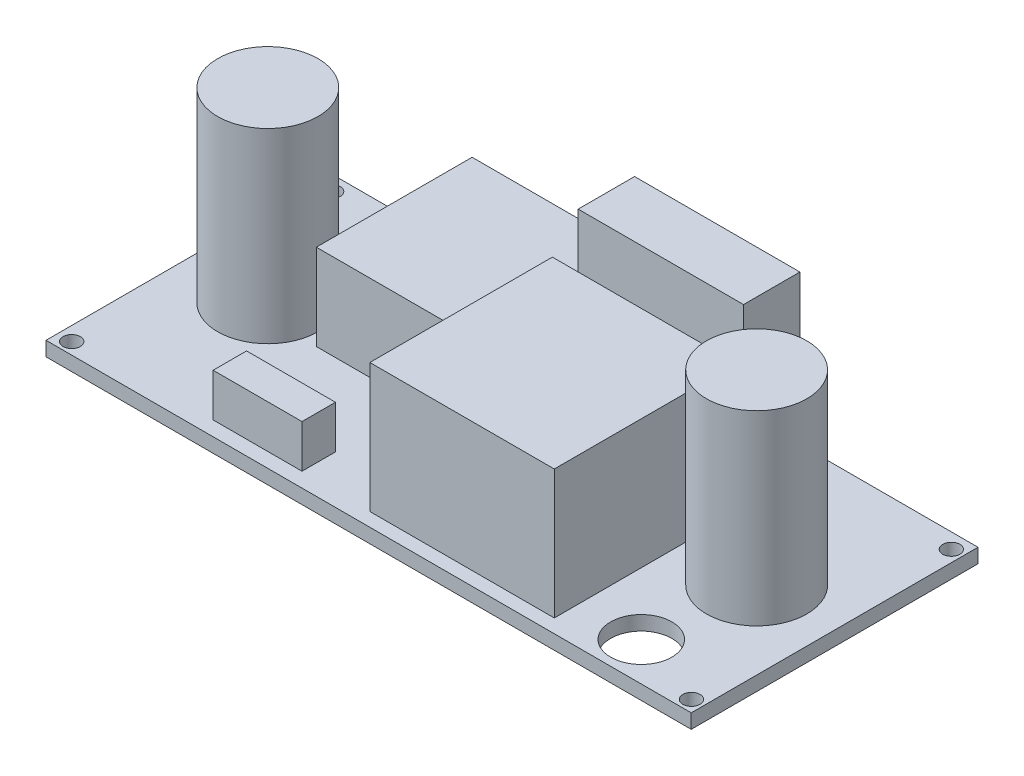
from build123d import *

# Parameters (mm, degrees)
SKETCH1_W           = 45
SKETCH1_H           = 20
BOSS_EXTRUDE1_DEPTH = 1
SKETCH2_R           = 3.5
BOSS_EXTRUDE3_DEPTH = 13
SKETCH3_W           = 11.530514465
SKETCH3_H           = 3.932371985
BOSS_EXTRUDE4_DEPTH = 11
SKETCH4_W           = 10.630734434
SKETCH4_H           = 10.864010739
SKETCH4_W_2         = 12.863521917
SKETCH4_H_2         = 12.730221172
BOSS_EXTRUDE5_DEPTH = 6
SKETCH5_W           = 12.863521917
SKETCH5_H           = 12.730221172
BOSS_EXTRUDE6_DEPTH = 3
SKETCH6_W           = 6.198484655
SKETCH6_H           = 2.332763042
BOSS_EXTRUDE7_DEPTH = 3
SKETCH7_R           = 0.6
SKETCH7_R_2         = 2.133853082
CUT_EXTRUDE1_DEPTH  = 28.843311585


with BuildPart() as part:
    # Sketch1 → Boss-Extrude1 (new body)
    with BuildSketch(Plane(origin=(0, 0, 0), x_dir=(1, 0, 0), z_dir=(0, 1, 0))):
        Rectangle(SKETCH1_W, SKETCH1_H)
    extrude(amount=BOSS_EXTRUDE1_DEPTH)

    # Sketch2 → Boss-Extrude3 (add)
    with BuildSketch(Plane(origin=(0, 1, 0), x_dir=(1, 0, 0), z_dir=(0, 1, 0))):
        with Locations(Location((-17.029170207, 0, 0), (0, 0, 90))):
            Circle(SKETCH2_R)
        with Locations(Location((17.062495393, 0, 0), (0, 0, 90))):
            Circle(SKETCH2_R)
    extrude(amount=BOSS_EXTRUDE3_DEPTH)

    # Sketch3 → Boss-Extrude4 (add)
    with BuildSketch(Plane(origin=(0, 1, 0), x_dir=(1, 0, 0), z_dir=(0, 1, 0))):
        with Locations((4.898802389, 7.448179142)):
            Rectangle(SKETCH3_W, SKETCH3_H)
    extrude(amount=BOSS_EXTRUDE4_DEPTH)

    # Sketch4 → Boss-Extrude5 (add)
    with BuildSketch(Plane(origin=(0, 1, 0), x_dir=(1, 0, 0), z_dir=(0, 1, 0))):
        with Locations((-7.381528769, 4.482237559)):
            Rectangle(SKETCH4_W, SKETCH4_H)
        with Locations((5.565306115, -2.682677498)):
            Rectangle(SKETCH4_W_2, SKETCH4_H_2)
    extrude(amount=BOSS_EXTRUDE5_DEPTH)

    # Sketch5 → Boss-Extrude6 (add)
    with BuildSketch(Plane(origin=(0, 7, 0), x_dir=(1, 0, 0), z_dir=(0, 1, 0))):
        with Locations((5.565306115, -2.682677498)):
            Rectangle(SKETCH5_W, SKETCH5_H)
    extrude(amount=BOSS_EXTRUDE6_DEPTH)

    # Sketch6 → Boss-Extrude7 (add)
    with BuildSketch(Plane(origin=(0, 1, 0), x_dir=(1, 0, 0), z_dir=(0, 1, 0))):
        with Locations((-8.764524, -7.814756191)):
            Rectangle(SKETCH6_W, SKETCH6_H)
    extrude(amount=BOSS_EXTRUDE7_DEPTH)

    # Sketch7 → Cut-Extrude1 (cut, through all)
    with BuildSketch(Plane(origin=(0, 1, 0), x_dir=(1, 0, 0), z_dir=(0, 1, 0))):
        with Locations(Location((-21.528070359, 8.947812525, 0), (0, 0, 270))):
            Circle(SKETCH7_R)
        with Locations(Location((-21.528070359, -9.18108883, 0), (0, 0, 270))):
            Circle(SKETCH7_R)
        with Locations(Location((21.694696291, -9.18108883, 0), (0, 0, 270))):
            Circle(SKETCH7_R)
        with Locations(Location((21.694696291, 8.947812525, 0), (0, 0, 270))):
            Circle(SKETCH7_R)
        with Locations(Location((16.329341294, -7.314878396, 0), (0, 0, 270))):
            Circle(SKETCH7_R_2)
    extrude(amount=-CUT_EXTRUDE1_DEPTH, mode=Mode.SUBTRACT)


solid = part.part
